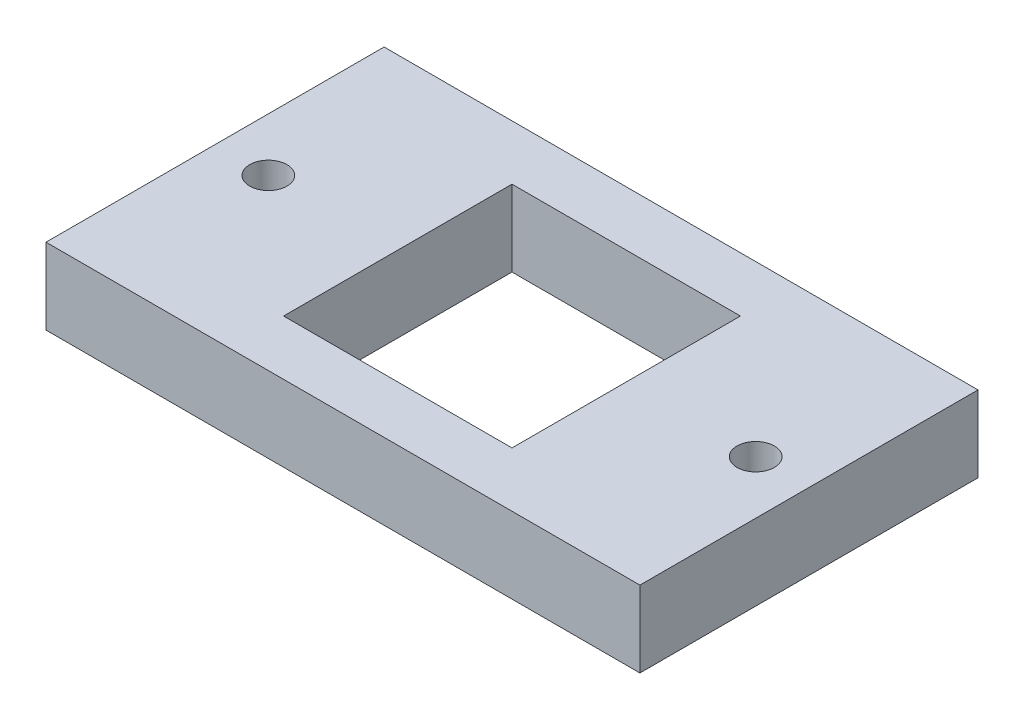
from build123d import *

# Parameters (mm, degrees)
SKETCH_1_W      = 39
SKETCH_1_H      = 22.2
SKETCH_1_R      = 1.225
SKETCH_1_W_2    = 15
SKETCH_1_H_2    = 15
EXTRUDE_1_DEPTH = 5


with BuildPart() as part:
    # 草图1 → 凸台-拉伸1 (new body)
    with BuildSketch(Plane(origin=(0, 0, 0), x_dir=(1, 0, 0), z_dir=(0, 1, 0))):
        with Locations((-36.196984523, 19.655669648)):
            Rectangle(SKETCH_1_W, SKETCH_1_H)
        with Locations(Location((-52.196984523, 19.655669648, 0), (0, 0, 270))):
            Circle(SKETCH_1_R, mode=Mode.SUBTRACT)
        with Locations(Location((-20.196984523, 19.655669648, 0), (0, 0, 270))):
            Circle(SKETCH_1_R, mode=Mode.SUBTRACT)
        with Locations((-36.196984523, 19.655669648)):
            Rectangle(SKETCH_1_W_2, SKETCH_1_H_2, mode=Mode.SUBTRACT)
    extrude(amount=EXTRUDE_1_DEPTH)


solid = part.part
